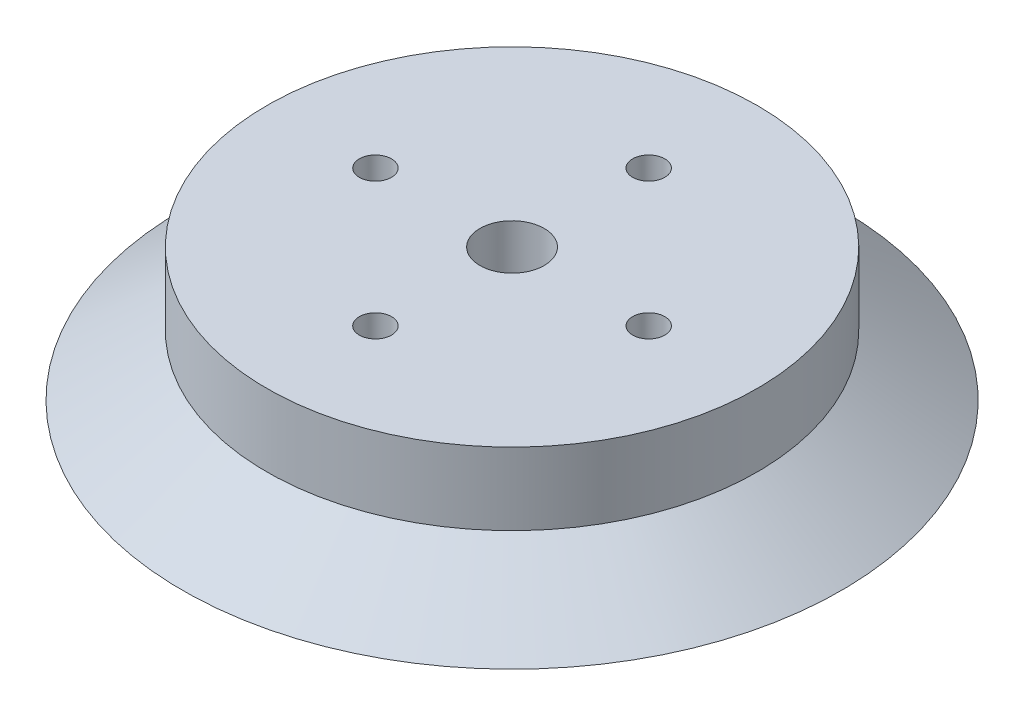
from build123d import *

# Parameters (mm, degrees)
SKETCH_2_R          = 4
SKETCH_2_R_2        = 2
CUT_EXTRUDE_1_DEPTH = 10


with BuildPart() as part:
    # 草图1 → 旋转1 (revolve)
    with BuildSketch(Plane.XY, mode=Mode.PRIVATE) as revolve_1_sk:
        Polygon((0, 16.5), (-30.5, 16.5), (-30.5, 7.5), (-41, 0), (-37.559069893, 0), (-27.059069893, 7.5), (0, 7.5), align=None)
    revolve(revolve_1_sk.sketch.rotate(Axis((0, 0, 0), (0, 1, 0)), 270), axis=Axis((0, 0, 0), (0, 1, 0)))

    # 草图2 → 切除-拉伸1 (cut)
    with BuildSketch(Plane.XZ.offset(-7.5)):
        with Locations(Location((0, 0, 0), (0, 0, 270))):
            Circle(SKETCH_2_R)
        with Locations(Location((0, 17, 0), (0, 0, 270))):
            Circle(SKETCH_2_R_2)
        with Locations(Location((17, 0, 0), (0, 0, 270))):
            Circle(SKETCH_2_R_2)
        with Locations(Location((0, -17, 0), (0, 0, 270))):
            Circle(SKETCH_2_R_2)
        with Locations(Location((-17, 0, 0), (0, 0, 270))):
            Circle(SKETCH_2_R_2)
    extrude(amount=-CUT_EXTRUDE_1_DEPTH, mode=Mode.SUBTRACT)


solid = part.part
